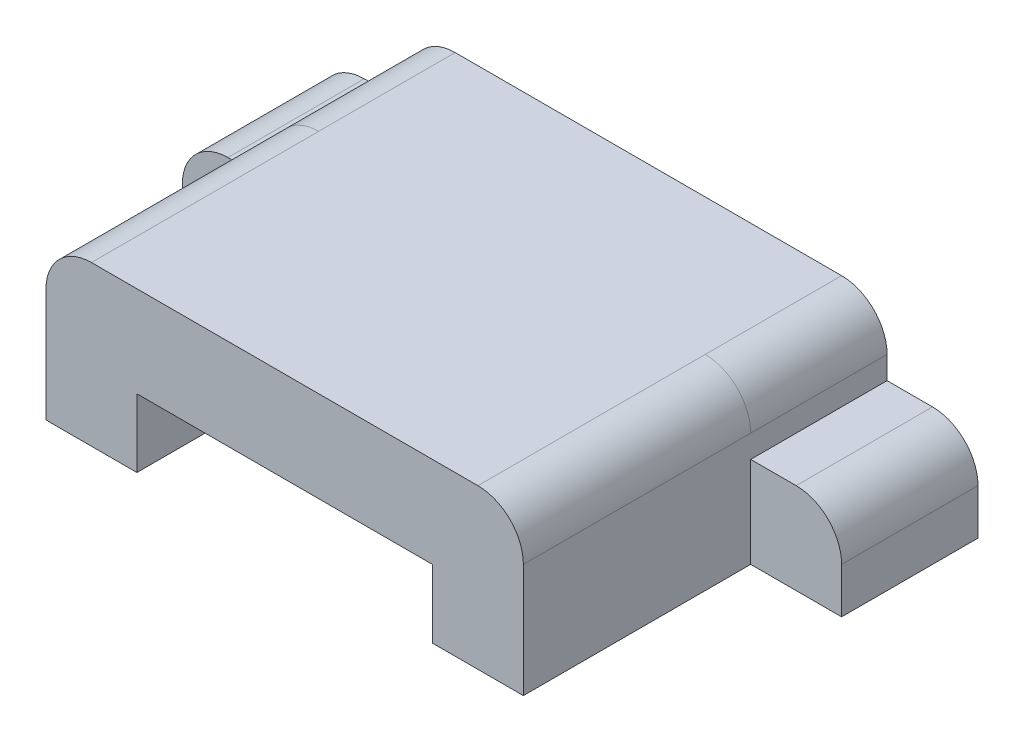
from build123d import *

# Parameters (mm, degrees)
BOSS_EXTRUDE1_DEPTH = 6
FILLET1_R           = 2
BOSS_EXTRUDE2_DEPTH = 10
FILLET2_R           = 2


with BuildPart() as part:
    # Sketch1 → Boss-Extrude1 (new body)
    with BuildSketch(Plane.XY):
        Polygon((-16.461538462, -8.743589744), (-8.461538462, -8.743589744), (-8.461538462, -5.743589744), (4.538461538, -5.743589744), (4.538461538, -8.743589744), (12.538461538, -8.743589744), (12.538461538, -4.743589744), (8.538461538, -4.743589744), (8.538461538, -1.743589744), (-12.461538462, -1.743589744), (-12.461538462, -4.743589744), (-16.461538462, -4.743589744), align=None)
    extrude(amount=BOSS_EXTRUDE1_DEPTH)

    # Fillet1
    fillet1_edges = [part.edges().sort_by_distance(p)[0] for p in [
        (-16.461538462, -4.743589744, 3),
        (-12.461538462, -1.743589744, 3),
        (8.538461538, -1.743589744, 3),
        (12.538461538, -4.743589744, 3),
    ]]
    fillet(fillet1_edges, radius=FILLET1_R)

    # Sketch3 → Boss-Extrude2 (add)
    with BuildSketch(Plane.XY.offset(6)):
        Polygon((-8.461538462, -5.743589744), (-8.461538462, -8.743589744), (-12.461538462, -8.743589744), (-12.461538462, -4.743589744), (-12.461538462, -1.743589744), (-10.461538462, -1.743589744), (8.538461538, -1.743589744), (8.538461538, -4.743589744), (8.538461538, -8.743589744), (4.538461538, -8.743589744), (4.538461538, -5.743589744), align=None)
    extrude(amount=BOSS_EXTRUDE2_DEPTH)

    # Fillet2
    fillet2_edges = [part.edges().sort_by_distance(p)[0] for p in [
        (8.538461538, -1.743589744, 11),
        (-12.461538462, -1.743589744, 11),
    ]]
    fillet(fillet2_edges, radius=FILLET2_R)


solid = part.part
